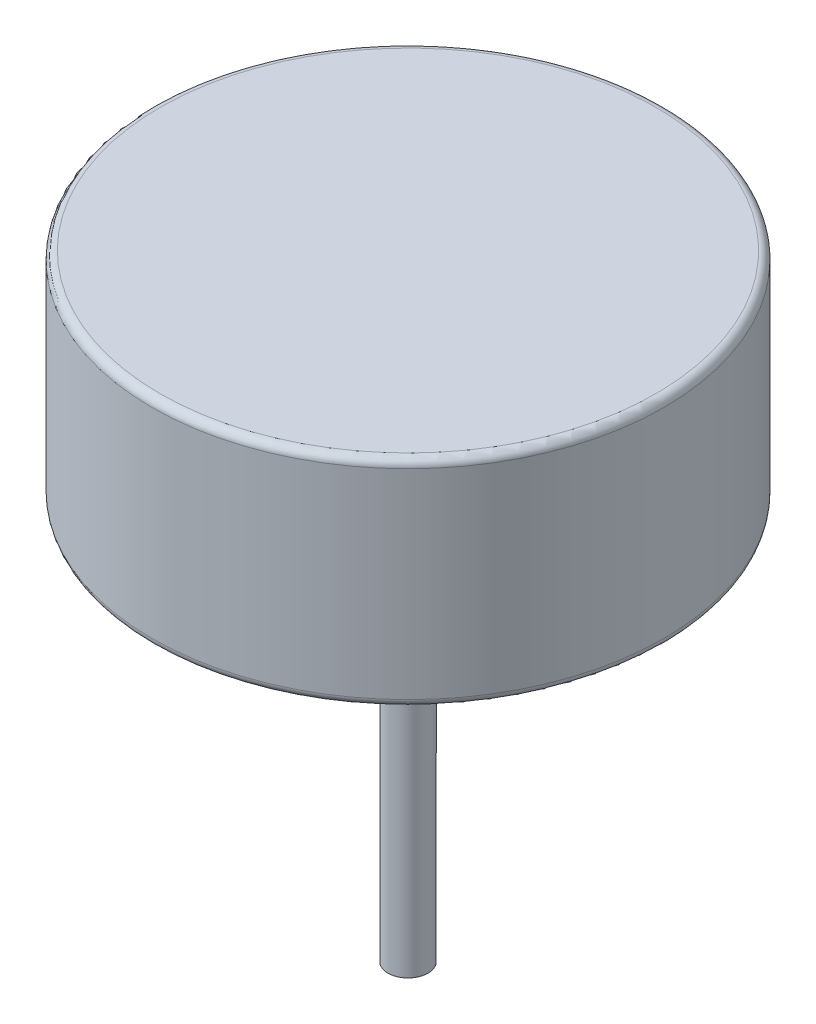
from build123d import *

# Parameters (mm, degrees)
SKETCH1_R           = 32
BOSS_EXTRUDE1_DEPTH = 13.5
FILLET1_R           = 1
FILLET2_R           = 1
SKETCH2_R           = 2.5
BOSS_EXTRUDE2_DEPTH = 50


with BuildPart() as part:
    # Sketch1 → Boss-Extrude1 (new, symmetric)
    with BuildSketch(Plane(origin=(0, 0, 0), x_dir=(1, 0, 0), z_dir=(0, 1, 0))):
        with Locations(Location((0, 0, 0), (0, 0, 270))):
            Circle(SKETCH1_R)
    extrude(amount=BOSS_EXTRUDE1_DEPTH, both=True)

    # Fillet1
    fillet1_edges = [part.edges().sort_by_distance(p)[0] for p in [
        (0, -13.5, -32),
    ]]
    fillet(fillet1_edges, radius=FILLET1_R)

    # Fillet2
    fillet2_edges = [part.edges().sort_by_distance(p)[0] for p in [
        (0, 13.5, -32),
    ]]
    fillet(fillet2_edges, radius=FILLET2_R)

    # Sketch2 → Boss-Extrude2 (add)
    with BuildSketch(Plane(origin=(0, -13.5, 0), x_dir=(-1, 0, 0), z_dir=(0, -1, 0))):
        with Locations(Location((0, 0, 0), (0, 0, 270))):
            Circle(SKETCH2_R)
    extrude(amount=BOSS_EXTRUDE2_DEPTH)


solid = part.part
